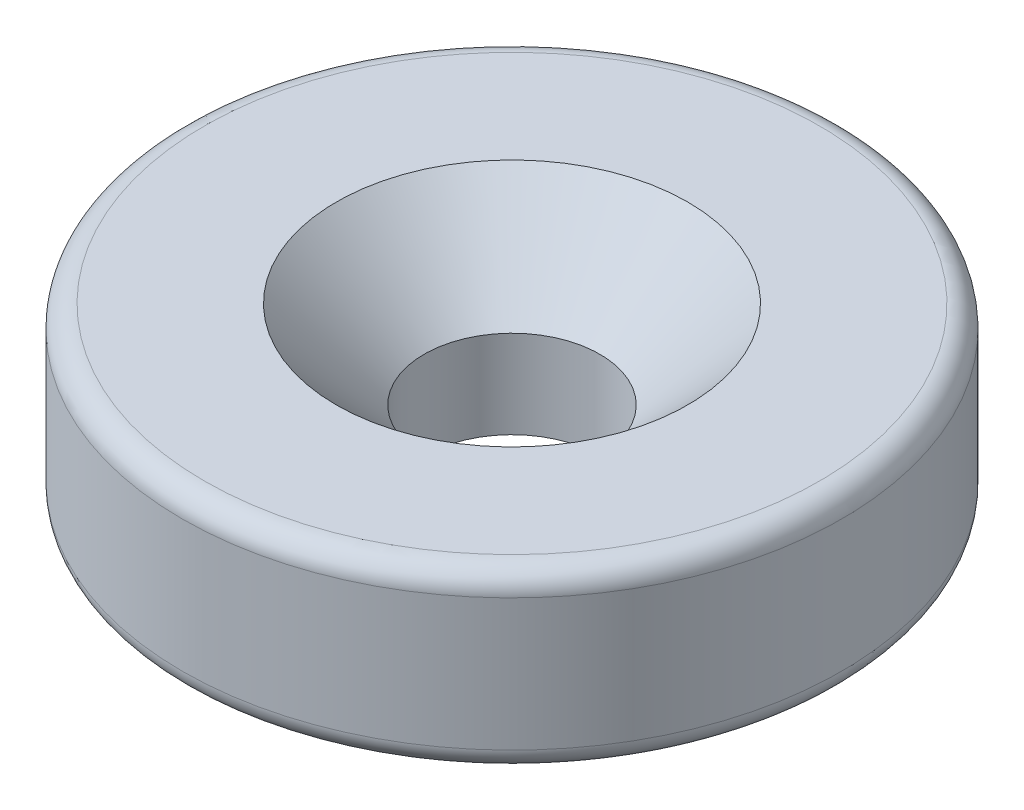
from build123d import *

# Parameters (mm, degrees)
SKETCH1_R           = 7.5
SKETCH1_R_2         = 2
BOSS_EXTRUDE1_DEPTH = 2
FILLET1_R           = 0.5
CHAMFER1_SIZE       = 2


with BuildPart() as part:
    # Sketch1 → Boss-Extrude1 (new, symmetric)
    with BuildSketch(Plane(origin=(0, 0, 0), x_dir=(1, 0, 0), z_dir=(0, 1, 0))):
        with Locations(Location((0, 0, 0), (0, 0, 270))):
            Circle(SKETCH1_R)
        with Locations(Location((0, 0, 0), (0, 0, 270))):
            Circle(SKETCH1_R_2, mode=Mode.SUBTRACT)
    extrude(amount=BOSS_EXTRUDE1_DEPTH, both=True)

    # Fillet1
    fillet1_edges = [part.edges().sort_by_distance(p)[0] for p in [
        (0, -2, -7.5),
        (0, 2, -7.5),
    ]]
    fillet(fillet1_edges, radius=FILLET1_R)

    # Chamfer1
    chamfer1_edges = [part.edges().sort_by_distance(p)[0] for p in [
        (0, 2, -2),
    ]]
    chamfer(chamfer1_edges, length=CHAMFER1_SIZE)


solid = part.part
